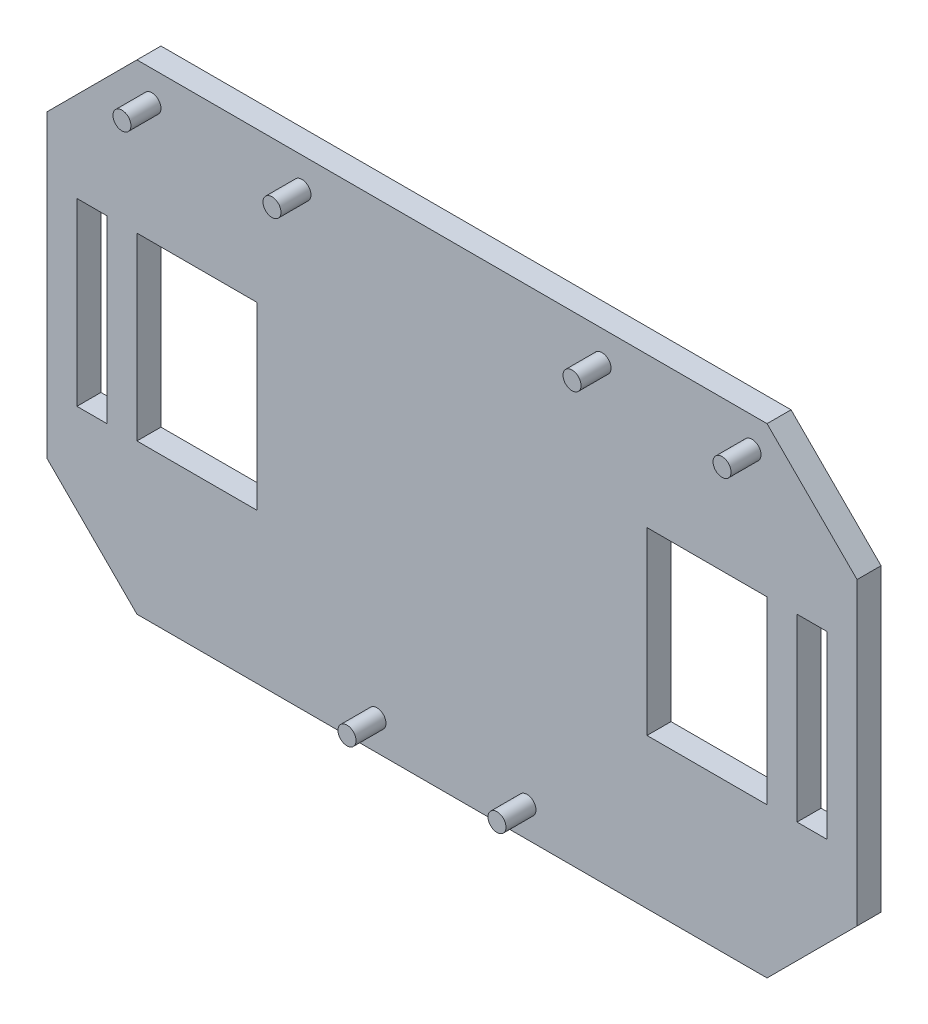
from build123d import *

# Parameters (mm, degrees)
ESQUISSE1_W             = 270
ESQUISSE1_H             = 160
BOSS_EXTRU_1_DEPTH      = 8
CHANFREIN1_SIZE         = 30
ESQUISSE2_W             = 40
ESQUISSE2_H             = 60
ESQUISSE2_W_2           = 10
ENL_V_MAT_EXTRU_1_DEPTH = 8
ESQUISSE3_R             = 3
BOSS_EXTRU_2_DEPTH      = 10


with BuildPart() as part:
    # Esquisse1 → Boss.-Extru.1 (new body)
    with BuildSketch(Plane.XY):
        with Locations((135, 80)):
            Rectangle(ESQUISSE1_W, ESQUISSE1_H)
    extrude(amount=BOSS_EXTRU_1_DEPTH)

    # Chanfrein1
    chanfrein1_edges = [part.edges().sort_by_distance(p)[0] for p in [
        (0, 160, 4),
        (270, 160, 4),
        (270, 0, 4),
        (0, 0, 4),
    ]]
    chamfer(chanfrein1_edges, length=CHANFREIN1_SIZE)

    # Esquisse2 → Enlèv. mat.-Extru.1 (cut)
    with BuildSketch(Plane.XY.offset(8)):
        with Locations((50, 80)):
            Rectangle(ESQUISSE2_W, ESQUISSE2_H)
        with Locations((15, 80)):
            Rectangle(ESQUISSE2_W_2, ESQUISSE2_H)
        with Locations((220, 80)):
            Rectangle(ESQUISSE2_W, ESQUISSE2_H)
        with Locations((255, 80)):
            Rectangle(ESQUISSE2_W_2, ESQUISSE2_H)
    extrude(amount=-ENL_V_MAT_EXTRU_1_DEPTH, mode=Mode.SUBTRACT)

    # Esquisse3 → Boss.-Extru.2 (add)
    with BuildSketch(Plane.XY.offset(8)):
        with Locations(Location((35, 150, 0), (0, 0, 180))):
            Circle(ESQUISSE3_R)
        with Locations(Location((85, 150, 0), (0, 0, 180))):
            Circle(ESQUISSE3_R)
        with Locations(Location((185, 150, 0), (0, 0, 180))):
            Circle(ESQUISSE3_R)
        with Locations(Location((235, 150, 0), (0, 0, 180))):
            Circle(ESQUISSE3_R)
        with Locations(Location((110, 10, 0), (0, 0, 180))):
            Circle(ESQUISSE3_R)
        with Locations(Location((160, 10, 0), (0, 0, 180))):
            Circle(ESQUISSE3_R)
    extrude(amount=BOSS_EXTRU_2_DEPTH)


solid = part.part
